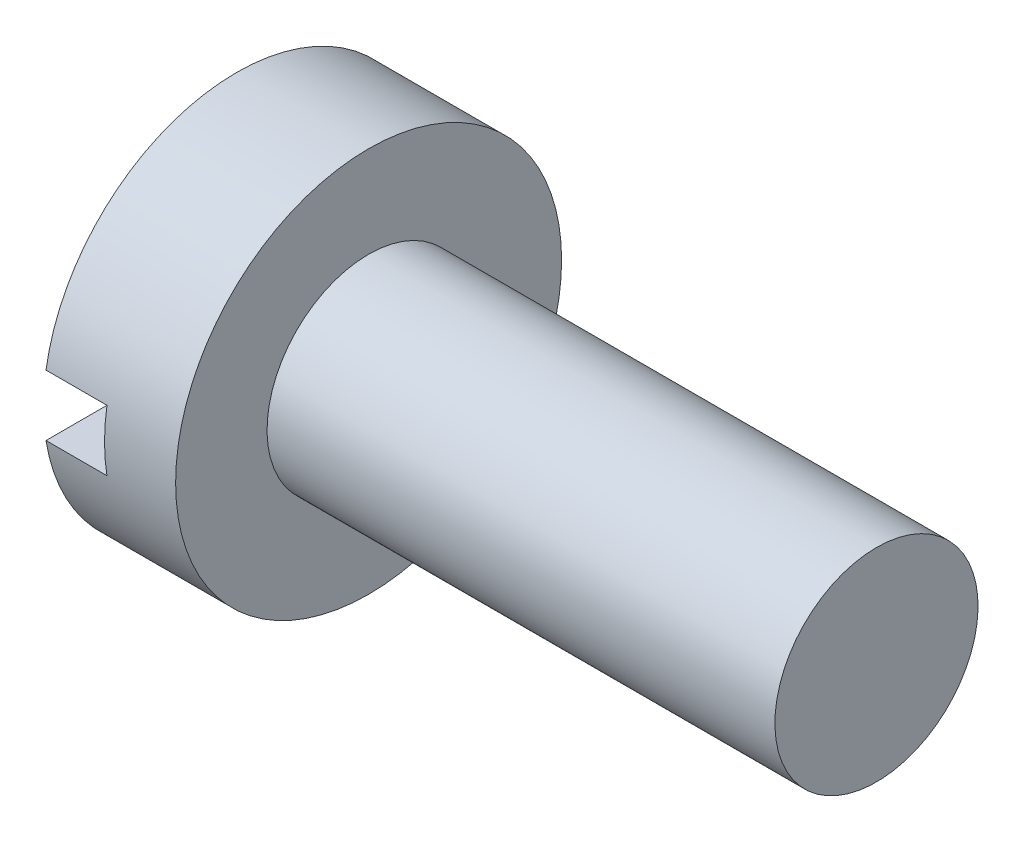
from build123d import *

# Parameters (mm, degrees)
SKETCH2_W          = 3.8
SKETCH2_H          = 0.6
CUT_EXTRUDE1_DEPTH = 0.6


with BuildPart() as part:
    # Sketch1 → Revolve1 (revolve)
    with BuildSketch(Plane.XY):
        Polygon((0, 0), (0, 1.9), (1.3, 1.9), (1.3, 1), (6.3, 1), (6.3, 0), align=None)
    revolve(axis=Axis((6.3, 0, 0), (-1, 0, 0)))

    # Sketch2 → Cut-Extrude1 (cut)
    with BuildSketch(Plane.ZY):
        Rectangle(SKETCH2_W, SKETCH2_H)
    extrude(amount=-CUT_EXTRUDE1_DEPTH, mode=Mode.SUBTRACT)


solid = part.part
